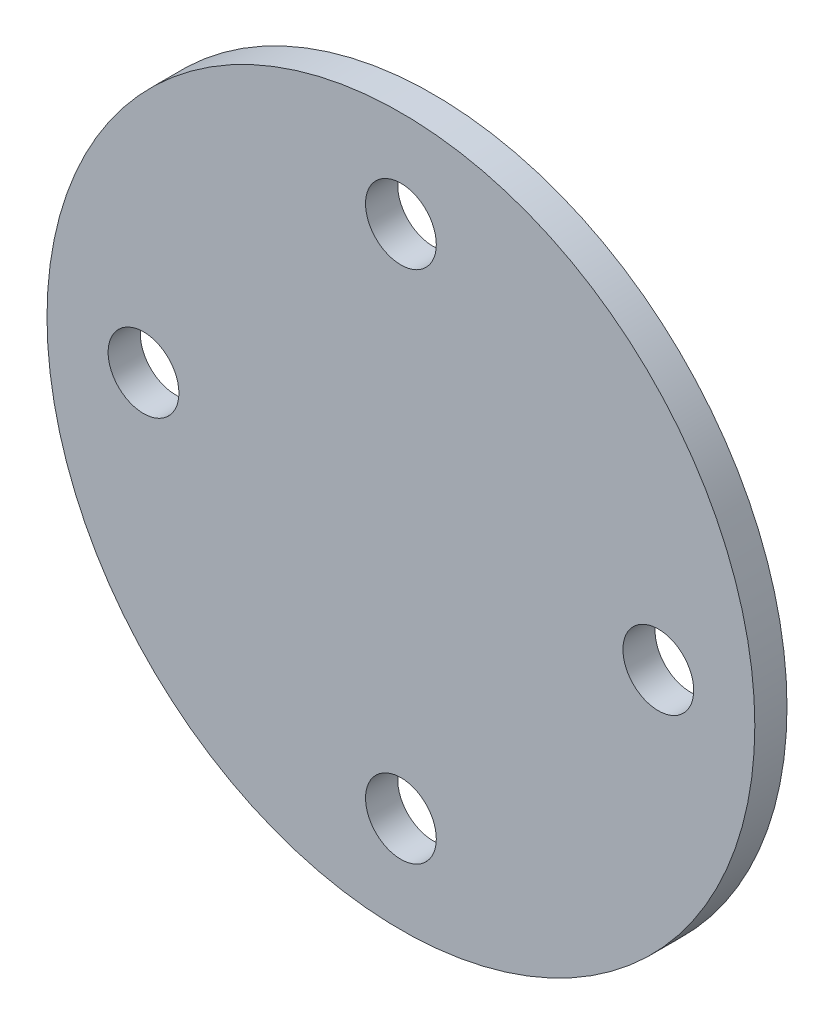
from build123d import *

# Parameters (mm, degrees)
CROQUIS2_R              = 11
CROQUIS2_R_2            = 1.1
SALIENTE_EXTRUIR1_DEPTH = 1


with BuildPart() as part:
    # Croquis2 → Saliente-Extruir1 (new body)
    with BuildSketch(Plane.XY):
        Circle(CROQUIS2_R)
        with Locations((0, 8)):
            Circle(CROQUIS2_R_2, mode=Mode.SUBTRACT)
        with Locations((8, 0)):
            Circle(CROQUIS2_R_2, mode=Mode.SUBTRACT)
        with Locations((0, -8)):
            Circle(CROQUIS2_R_2, mode=Mode.SUBTRACT)
        with Locations((-8, 0)):
            Circle(CROQUIS2_R_2, mode=Mode.SUBTRACT)
    extrude(amount=SALIENTE_EXTRUIR1_DEPTH)


solid = part.part
